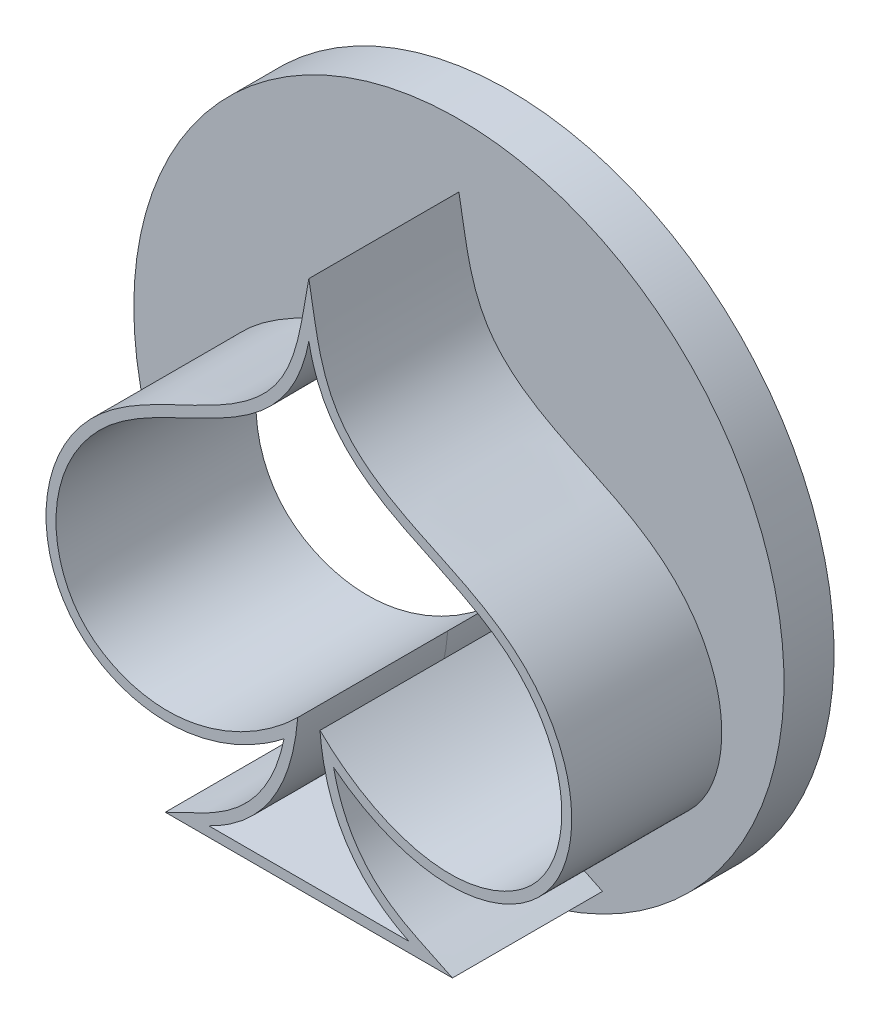
from build123d import *

# Parameters (mm, degrees)
BOSS_EXTRUDE1_DEPTH = 3
SKETCH3_R           = 6.5
BOSS_EXTRUDE2_DEPTH = 1
CUT_EXTRUDE1_DEPTH  = 1


with BuildPart() as part:
    # Sketch2 → Boss-Extrude1 (new body)
    with BuildSketch(Plane.XY):
        with BuildLine():
            Line((2.87074218, -0.2), (-2.87074218, -0.2))
            add(Edge.make_bspline(
                [(-2.87074218, -0.2), (-2.538180712, -0.03643845), (-1.870747963, 0.278116546), (-1.259779082, 0.714931464), (-0.640678292, 1.55412408), (-0.494956523, 2.259456138)],
                knots=[-0.242380713, -0.242380713, -0.242380713, -0.036374815, 0.169631083, 0.444305614, 0.85631741, 0.85631741, 0.85631741], degree=2))
            add(Edge.make_bspline(
                [(-0.494956523, 2.259456138), (-0.998757074, 1.866853861), (-1.88650627, 1.408203003), (-3.199388622, 1.341041772), (-4.179603447, 1.653624475), (-4.945573251, 2.355597024), (-5.40186826, 3.654293523), (-5.096339968, 4.999707608), (-4.267962031, 6.018497552), (-3.487598097, 6.561167834), (-2.650564295, 6.967368655), (-1.829786906, 7.349523896), (-1.104957636, 7.800170243), (-0.533078904, 8.401100618), (-0.188909183, 9.263346572), (-0.071836227, 10.09195793), (0, 10.47468172)],
                knots=[0.037621246, 0.037621246, 0.037621246, 0.037621246, 0.165142491, 0.228903114, 0.292663737, 0.35642436, 0.420184982, 0.547706228, 0.611466851, 0.675227474, 0.738988096, 0.802748719, 0.866509342, 0.930269965, 0.994030588, 1.05779121, 1.05779121, 1.05779121, 1.05779121], degree=3))
            add(Edge.make_bspline(
                [(0, 10.47468172), (0.071836227, 10.09195793), (0.188909183, 9.263346572), (0.533078904, 8.401100618), (1.104957636, 7.800170243), (1.829786906, 7.349523896), (2.650564295, 6.967368655), (3.487598097, 6.561167834), (4.267962031, 6.018497552), (5.096339968, 4.999707608), (5.40186826, 3.654293523), (4.945573251, 2.355597024), (4.179603447, 1.653624475), (3.199388622, 1.341041772), (1.88650627, 1.408203003), (0.998757074, 1.866853861), (0.494956523, 2.259456138)],
                knots=[0.037621246, 0.037621246, 0.037621246, 0.037621246, 0.101381868, 0.165142491, 0.228903114, 0.292663737, 0.35642436, 0.420184982, 0.483945605, 0.547706228, 0.675227474, 0.738988096, 0.802748719, 0.866509342, 0.930269965, 1.05779121, 1.05779121, 1.05779121, 1.05779121], degree=3))
            add(Edge.make_bspline(
                [(0.494956523, 2.259456138), (0.640678292, 1.55412408), (1.259779082, 0.714931464), (1.870747963, 0.278116546), (2.538180712, -0.03643845), (2.87074218, -0.2)],
                knots=[-0.242380713, -0.242380713, -0.242380713, 0.169631083, 0.444305614, 0.650311512, 0.85631741, 0.85631741, 0.85631741], degree=2))
        make_face()
        with BuildLine():
            Line((2, 0), (-2, 0))
            add(Edge.make_bspline(
                [(-2, 0), (-0.383801435, 0.783797298), (-0.222681986, 2.763561711)],
                knots=[0, 0, 0, 1, 1, 1], degree=2))
            add(Edge.make_bspline(
                [(-0.222681986, 2.763561711), (-0.980618287, 2.016699581), (-2.632495168, 1.170670325), (-4.596720663, 2.102114537), (-5.159361168, 3.425948532), (-4.965828288, 4.80046081), (-3.273320318, 7.0981265), (-0.434868057, 7.073670921), (0, 9.390529103)],
                knots=[0, 0, 0, 0, 0.233244408, 0.336385653, 0.419960694, 0.519898355, 0.616443771, 1, 1, 1, 1], degree=3))
            add(Edge.make_bspline(
                [(0.222681986, 2.763561711), (0.980618287, 2.016699581), (2.632495168, 1.170670325), (4.596720663, 2.102114537), (5.159361168, 3.425948532), (4.965828288, 4.80046081), (3.273320318, 7.0981265), (0.434868057, 7.073670921), (0, 9.390529103)],
                knots=[0, 0, 0, 0, 0.233244408, 0.336385653, 0.419960694, 0.519898355, 0.616443771, 1, 1, 1, 1], degree=3))
            add(Edge.make_bspline(
                [(2, 0), (0.383801435, 0.783797298), (0.222681986, 2.763561711)],
                knots=[0, 0, 0, 1, 1, 1], degree=2))
        make_face(mode=Mode.SUBTRACT)
    extrude(amount=BOSS_EXTRUDE1_DEPTH)

    # Sketch3 → Boss-Extrude2 (add)
    with BuildSketch(Plane(origin=(0, 0, 0), x_dir=(-1, 0, 0), z_dir=(0, 0, -1))):
        with Locations((0, 5.23734086)):
            Circle(SKETCH3_R)
    extrude(amount=BOSS_EXTRUDE2_DEPTH)

    # Sketch4 → Cut-Extrude1 (cut)
    with BuildSketch(Plane.XY):
        with BuildLine():
            Line((-2, 0), (2, 0))
            add(Edge.make_bspline(
                [(2, 0), (0.383801435, 0.783797298), (0.222681986, 2.763561711)],
                knots=[0, 0, 0, 1, 1, 1], degree=2))
            add(Edge.make_bspline(
                [(0.222681986, 2.763561711), (0.980618287, 2.016699581), (2.632495168, 1.170670325), (4.596720663, 2.102114537), (5.159361168, 3.425948532), (4.965828288, 4.80046081), (3.273320318, 7.0981265), (0.434868057, 7.073670921), (0, 9.390529103)],
                knots=[0, 0, 0, 0, 0.233244408, 0.336385653, 0.419960694, 0.519898355, 0.616443771, 1, 1, 1, 1], degree=3))
            add(Edge.make_bspline(
                [(0, 9.390529103), (-0.434868057, 7.073670921), (-3.273320318, 7.0981265), (-4.965828288, 4.80046081), (-5.159361168, 3.425948532), (-4.596720663, 2.102114537), (-2.632495168, 1.170670325), (-0.980618287, 2.016699581), (-0.222681986, 2.763561711)],
                knots=[0, 0, 0, 0, 0.383556229, 0.480101645, 0.580039306, 0.663614347, 0.766755592, 1, 1, 1, 1], degree=3))
            add(Edge.make_bspline(
                [(-0.222681986, 2.763561711), (-0.383801435, 0.783797298), (-2, 0)],
                knots=[0, 0, 0, 1, 1, 1], degree=2))
        make_face()
    extrude(amount=-CUT_EXTRUDE1_DEPTH, mode=Mode.SUBTRACT)


solid = part.part
